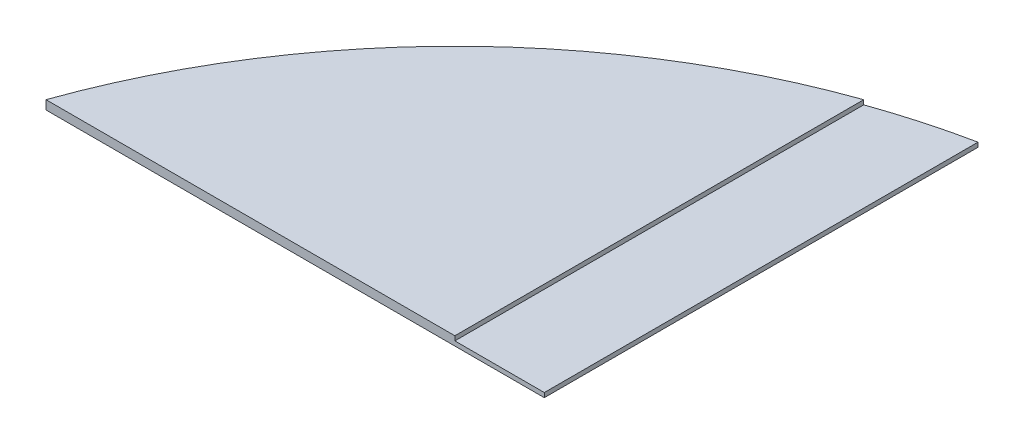
from build123d import *

# Parameters (mm, degrees)
BOSS_EXTRUDE1_DEPTH = 1
BOSS_EXTRUDE2_DEPTH = 1
CUT_EXTRUDE1_DEPTH  = 208.84850252


with BuildPart() as part:
    # Sketch1 → Boss-Extrude1 (new body)
    with BuildSketch(Plane(origin=(0, 0, 0), x_dir=(1, 0, 0), z_dir=(0, 1, 0))):
        with BuildLine():
            Line((-50, 50), (-30, 50))
            Line((-30, 50), (-30, 146.969384567))
            ThreePointArc((-30, 146.969384567), (-106.066017178, 106.066017178), (-146.969384567, 30))
            Line((-146.969384567, 30), (-50, 30))
            Line((-50, 30), (-50, 50))
        make_face()
    extrude(amount=BOSS_EXTRUDE1_DEPTH)

    # Sketch2 → Boss-Extrude2 (add)
    with BuildSketch(Plane(origin=(0, 1, 0), x_dir=(-1, 0, 0), z_dir=(0, 1, 0))):
        with BuildLine():
            Line((50, -50), (141.421356237, -50))
            ThreePointArc((141.421356237, -50), (106.066017178, -106.066017178), (50, -141.421356237))
            Line((50, -141.421356237), (50, -50))
        make_face()
    extrude(amount=BOSS_EXTRUDE2_DEPTH)

    # Sketch3 → Cut-Extrude1 (cut, through all)
    with BuildSketch(Plane(origin=(0, 1, 0), x_dir=(1, 0, 0), z_dir=(0, 1, 0))):
        with BuildLine():
            Line((-50, 50), (-141.421356237, 50))
            ThreePointArc((-141.421356237, 50), (-144.541706249, 40.096074055), (-146.969384567, 30))
            Line((-146.969384567, 30), (-50, 30))
            Line((-50, 30), (-50, 50))
        make_face()
    extrude(amount=-CUT_EXTRUDE1_DEPTH, mode=Mode.SUBTRACT)


solid = part.part
